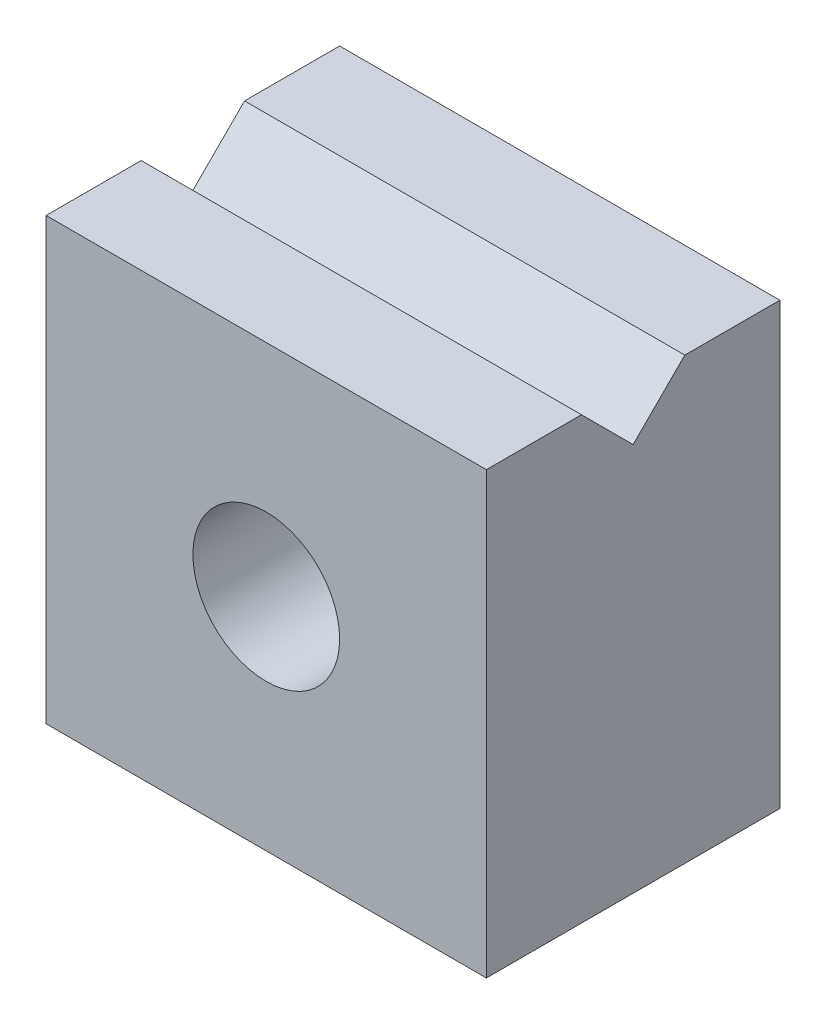
from build123d import *

# Parameters (mm, degrees)
SKETCH1_W           = 19.05
SKETCH1_H           = 19.05
BOSS_EXTRUDE1_DEPTH = 12.7
SKETCH2_R           = 3.175
CUT_EXTRUDE1_DEPTH  = 12.7
CUT_EXTRUDE2_DEPTH  = 25.797542721


with BuildPart() as part:
    # Sketch1 → Boss-Extrude1 (new body)
    with BuildSketch(Plane.XY):
        Rectangle(SKETCH1_W, SKETCH1_H)
    extrude(amount=BOSS_EXTRUDE1_DEPTH)

    # Sketch2 → Cut-Extrude1 (cut)
    with BuildSketch(Plane.XY.offset(12.7)):
        Circle(SKETCH2_R)
    extrude(amount=-CUT_EXTRUDE1_DEPTH, mode=Mode.SUBTRACT)

    # Sketch3 → Cut-Extrude2 (cut, through all)
    with BuildSketch(Plane(origin=(9.525, 0, 0), x_dir=(0, 0, -1), z_dir=(1, 0, 0))):
        Polygon((-6.35, 7.2898), (-4.1148, 9.525), (-8.5852, 9.525), align=None)
    extrude(amount=-CUT_EXTRUDE2_DEPTH, mode=Mode.SUBTRACT)


solid = part.part
